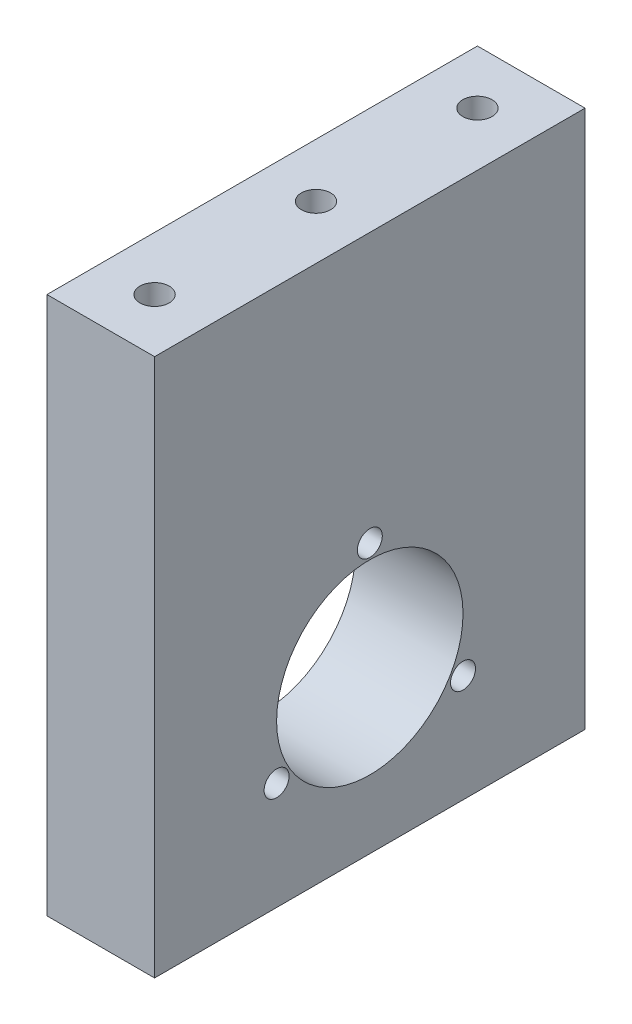
from build123d import *

# Parameters (mm, degrees)
SKETCH1_W                  = 50.8
SKETCH1_H                  = 63.5
BOSS_EXTRUDE1_DEPTH        = 12.7
F_22_0_22_DIAMETER_HOLE1_D = 22
F_8_32_TAPPED_HOLE1_D      = 3.4544
F_8_32_TAPPED_HOLE1_DEPTH  = 10.668
F_8_32_TAPPED_HOLE1_TIP    = 1.037806461
F_4_CLEARANCE_HOLE1_D      = 2.9464
CIRPATTERN1_COUNT          = 3


with BuildPart() as part:
    # Sketch1 → Boss-Extrude1 (new body)
    with BuildSketch(Plane(origin=(0, 0, 0), x_dir=(0, 0, -1), z_dir=(1, 0, 0))):
        Rectangle(SKETCH1_W, SKETCH1_H)
    extrude(amount=BOSS_EXTRUDE1_DEPTH)

    # Ø22.0 (22) Diameter Hole1 (through all)
    with Locations(Plane(origin=(12.7, 0, 0), x_dir=(0, 0, -1), z_dir=(1, 0, 0))):
        with Locations((0, -12.7)):
            Hole(F_22_0_22_DIAMETER_HOLE1_D / 2)

    # #8-32 Tapped Hole1
    with Locations(Plane(origin=(0, 31.75, 0), x_dir=(1, 0, 0), z_dir=(0, 1, 0))):
        with Locations((6.35, 19.05), (6.35, -19.05), (6.35, 0)):
            Hole(F_8_32_TAPPED_HOLE1_D / 2, depth=F_8_32_TAPPED_HOLE1_DEPTH)
            with Locations((0, 0, -(F_8_32_TAPPED_HOLE1_DEPTH + F_8_32_TAPPED_HOLE1_TIP / 2))):  # 118° drill point
                Cone(0, F_8_32_TAPPED_HOLE1_D / 2, F_8_32_TAPPED_HOLE1_TIP, mode=Mode.SUBTRACT)

    # #4 Clearance Hole1 (through all)
    with Locations(Plane.ZY):
        with Locations((0, 0)):
            f_4_clearance_hole1 = Hole(F_4_CLEARANCE_HOLE1_D / 2)

    # CirPattern1: #4 Clearance Hole1 ×3 about axis
    cirpattern1_axis = Axis((0, -12.7, 0), (1, 0, 0))
    for i in range(1, CIRPATTERN1_COUNT):
        add(f_4_clearance_hole1.rotate(cirpattern1_axis, i * 360 / CIRPATTERN1_COUNT), mode=Mode.SUBTRACT)


solid = part.part
